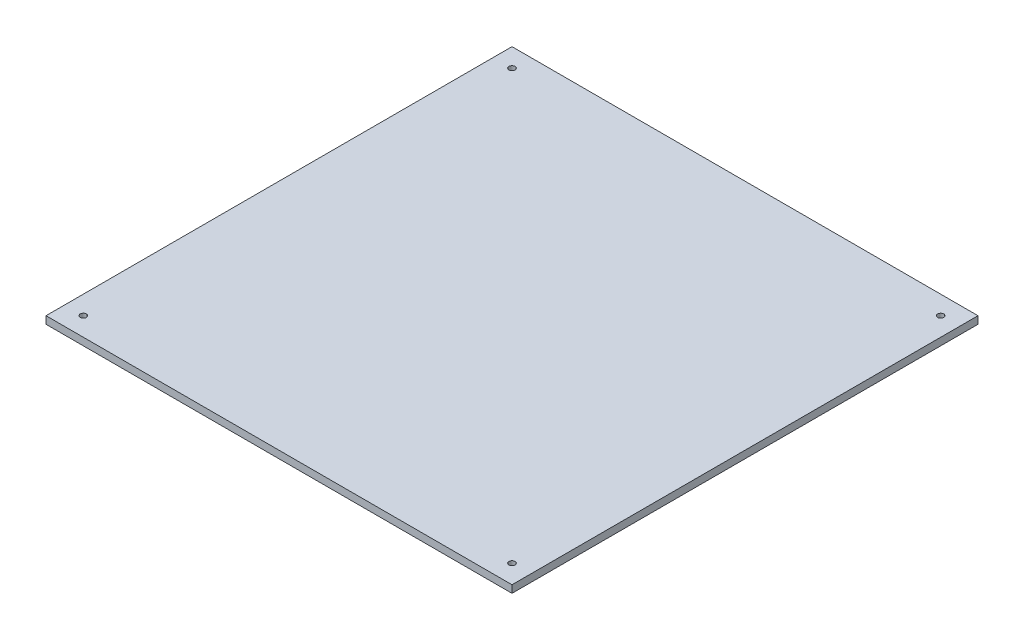
from build123d import *

# Parameters (mm, degrees)
SKETCH1_W           = 250
SKETCH1_H           = 250
SKETCH1_R           = 1.65
BOSS_EXTRUDE1_DEPTH = 4


with BuildPart() as part:
    # Sketch1 → Boss-Extrude1 (new body)
    with BuildSketch(Plane(origin=(0, 0, 0), x_dir=(1, 0, 0), z_dir=(0, 1, 0))):
        with Locations((125, 125)):
            Rectangle(SKETCH1_W, SKETCH1_H)
        with Locations(Location((10, 10, 0), (0, 0, 270))):
            Circle(SKETCH1_R, mode=Mode.SUBTRACT)
        with Locations(Location((240, 10, 0), (0, 0, 90))):
            Circle(SKETCH1_R, mode=Mode.SUBTRACT)
        with Locations(Location((240, 240, 0), (0, 0, 270))):
            Circle(SKETCH1_R, mode=Mode.SUBTRACT)
        with Locations(Location((10, 240, 0), (0, 0, 90))):
            Circle(SKETCH1_R, mode=Mode.SUBTRACT)
    extrude(amount=BOSS_EXTRUDE1_DEPTH)


solid = part.part
